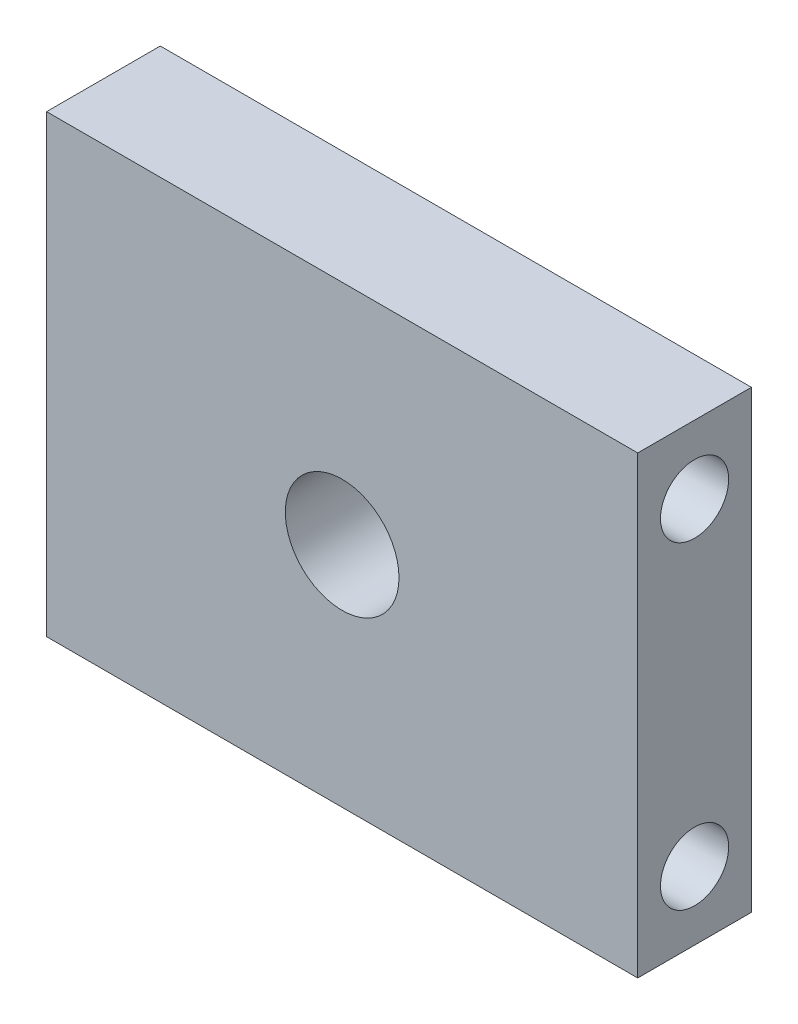
from build123d import *

# Parameters (mm, degrees)
SKETCH1_W           = 26
SKETCH1_H           = 20
BOSS_EXTRUDE1_DEPTH = 5
SKETCH2_R           = 2.5
CUT_EXTRUDE1_DEPTH  = 5
CUT_EXTRUDE2_REACH  = 30.302
SKETCH3_R           = 1.5


with BuildPart() as part:
    # Sketch1 → Boss-Extrude1 (new body)
    with BuildSketch(Plane.XY):
        Rectangle(SKETCH1_W, SKETCH1_H)
    extrude(amount=BOSS_EXTRUDE1_DEPTH)

    # Sketch2 → Cut-Extrude1 (cut)
    with BuildSketch(Plane.XY.offset(5)):
        Circle(SKETCH2_R)
    extrude(amount=-CUT_EXTRUDE1_DEPTH, mode=Mode.SUBTRACT)

    # Sketch3 → Cut-Extrude2 (cut, up to next)
    with BuildSketch(Plane.ZY.offset(13), mode=Mode.PRIVATE) as cut_extrude2_sk1:
        with Locations((2.5, 7)):
            Circle(SKETCH3_R)
    cut_extrude2_tool1 = extrude(cut_extrude2_sk1.sketch, amount=-CUT_EXTRUDE2_REACH, mode=Mode.PRIVATE) & part.part
    # Sketch3 → Cut-Extrude2 (cut, up to next)
    with BuildSketch(Plane.ZY.offset(13), mode=Mode.PRIVATE) as cut_extrude2_sk2:
        with Locations(Location((2.5, -7, 0), (0, 0, 270))):
            Circle(SKETCH3_R)
    cut_extrude2_tool2 = extrude(cut_extrude2_sk2.sketch, amount=-CUT_EXTRUDE2_REACH, mode=Mode.PRIVATE) & part.part
    add(cut_extrude2_tool1.solids().sort_by_distance((-13, 7, 2.5))[0], mode=Mode.SUBTRACT)
    add(cut_extrude2_tool2.solids().sort_by_distance((-13, -7, 2.5))[0], mode=Mode.SUBTRACT)


solid = part.part
